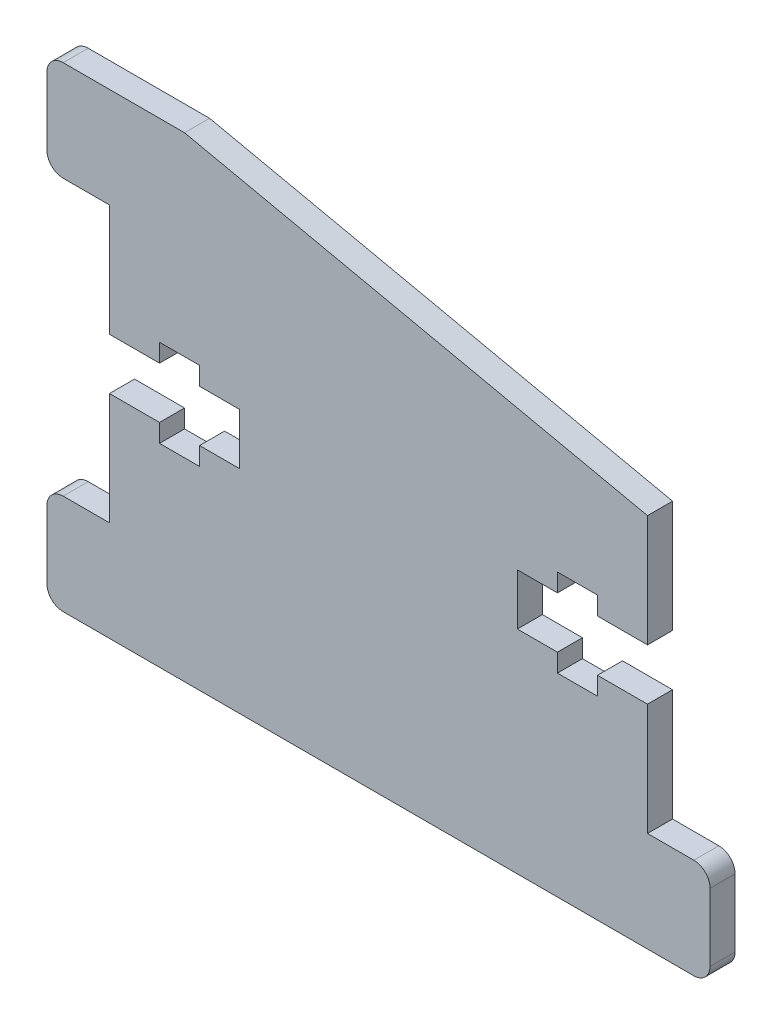
from build123d import *

# Parameters (mm, degrees)
EXTRUDE_1_DEPTH = 2
FILLET_1_R      = 1.3


with BuildPart() as part:
    # 草图1 → 凸台-拉伸1 (new body)
    with BuildSketch(Plane.XY):
        Polygon((-35.523824953, 30.239854129), (-30.523824953, 30.239854129), (12.476175047, 30.239854129), (17.476175047, 30.239854129), (17.476175047, 38.239854129), (12.476175047, 38.239854129), (12.476175047, 47.189854129), (8.476175047, 47.189854129), (8.476175047, 45.739854129), (5.276175047, 45.739854129), (5.276175047, 47.189854129), (2.076175047, 47.189854129), (2.076175047, 51.289854129), (5.276175047, 51.289854129), (5.276175047, 52.739854129), (8.476175047, 52.739854129), (8.476175047, 51.289854129), (12.476175047, 51.289854129), (12.476175047, 60.239854129), (-24.523824953, 68.239854129), (-30.523824953, 68.239854129), (-35.523824953, 68.239854129), (-35.523824953, 60.239854129), (-30.523824953, 60.239854129), (-30.523824953, 51.289854129), (-26.523824953, 51.289854129), (-26.523824953, 52.739854129), (-23.323824953, 52.739854129), (-23.323824953, 51.289854129), (-20.123824953, 51.289854129), (-20.123824953, 47.189854129), (-23.323824953, 47.189854129), (-23.323824953, 45.739854129), (-26.523824953, 45.739854129), (-26.523824953, 47.189854129), (-30.523824953, 47.189854129), (-30.523824953, 38.239854129), (-35.523824953, 38.239854129), align=None)
    extrude(amount=EXTRUDE_1_DEPTH)

    # 圆角1
    fillet_1_edges = [part.edges().sort_by_distance(p)[0] for p in [
        (-35.523824953, 60.239854129, 1),
        (-35.523824953, 68.239854129, 1),
        (17.476175047, 38.239854129, 1),
        (17.476175047, 30.239854129, 1),
        (-35.523824953, 30.239854129, 1),
        (-35.523824953, 38.239854129, 1),
    ]]
    fillet(fillet_1_edges, radius=FILLET_1_R)


solid = part.part
